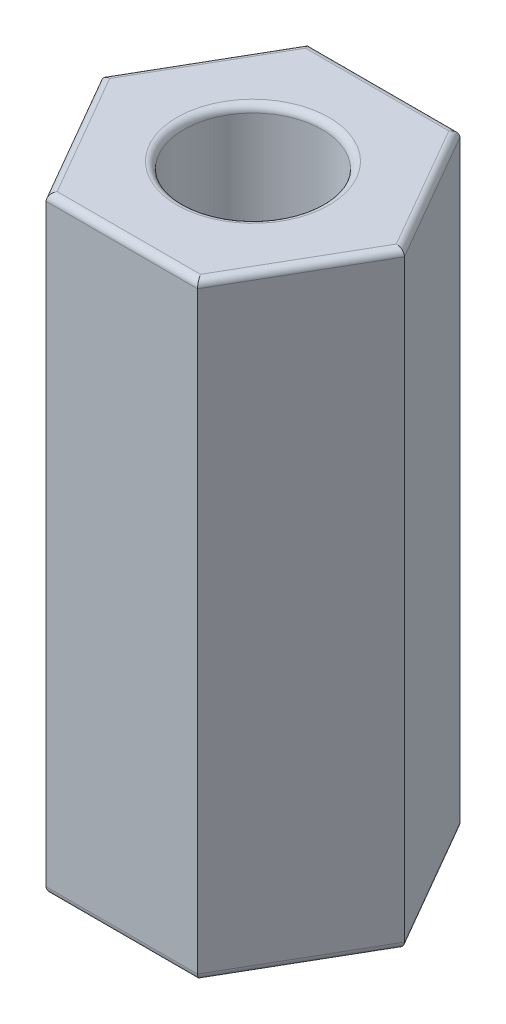
from build123d import *

# Parameters (mm, degrees)
BOSS_EXTRUDE1_DEPTH   = 5.5
M3X0_5_TAPPED_HOLE1_D = 2.5
FILLET1_R             = 0.127


with BuildPart() as part:
    # Sketch1 → Boss-Extrude1 (new, symmetric)
    with BuildSketch(Plane(origin=(0, 0, 0), x_dir=(1, 0, 0), z_dir=(0, 1, 0))):
        Polygon((2.742298309, 0), (1.371149154, 2.3749), (-1.371149154, 2.3749), (-2.742298309, 0), (-1.371149154, -2.3749), (1.371149154, -2.3749), align=None)
    extrude(amount=BOSS_EXTRUDE1_DEPTH, both=True)

    # M3x0.5 Tapped Hole1 (through all)
    with Locations(Plane(origin=(0, 5.5, 0), x_dir=(1, 0, 0), z_dir=(0, 1, 0))):
        with Locations((0, 0)):
            Hole(M3X0_5_TAPPED_HOLE1_D / 2)

    # Fillet1
    fillet1_edges = [part.edges().sort_by_distance(p)[0] for p in [
        (0, 5.5, -2.3749),
        (-2.056723731, 5.5, -1.18745),
        (-2.056723731, 5.5, 1.18745),
        (0, 5.5, 2.3749),
        (1.25, 5.5, 0),
        (1.25, -5.5, 0),
        (2.056723731, 5.5, 1.18745),
        (0, -5.5, 2.3749),
        (-2.056723731, -5.5, 1.18745),
        (-2.056723731, -5.5, -1.18745),
        (2.056723731, 5.5, -1.18745),
        (0, -5.5, -2.3749),
        (2.056723731, -5.5, -1.18745),
        (2.056723731, -5.5, 1.18745),
    ]]
    fillet(fillet1_edges, radius=FILLET1_R)


solid = part.part
